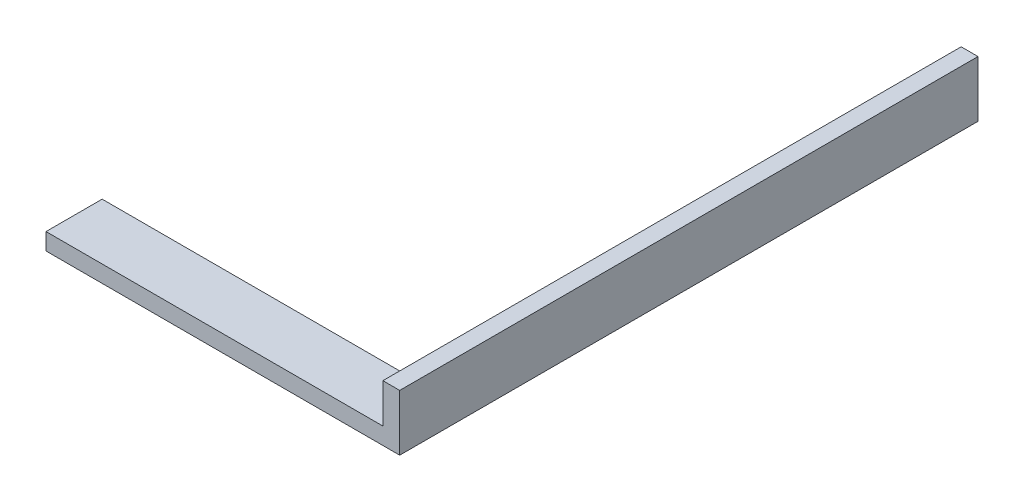
from build123d import *

# Parameters (mm, degrees)
SKETCH_1_W          = 63
SKETCH_1_H          = 10
EXTRUDE_1_DEPTH     = 2
SKETCH_4_W          = 2
SKETCH_4_H          = 10
EXTRUDE_2_DEPTH     = 93
SKETCH_5_W          = 61
SKETCH_5_H          = 10
EXTRUDE_3_DEPTH     = 1
SKETCH_6_W          = 10
SKETCH_6_H          = 92
EXTRUDE_4_DEPTH     = 1
SKETCH_7_W          = 3
SKETCH_7_H          = 10
EXTRUDE_5_DEPTH     = 93
SKETCH_10_W         = 26.594312394
SKETCH_10_H         = 101.559656513
CUT_EXTRUDE_1_DEPTH = 93


with BuildPart() as part:
    # 草图1 → 凸台-拉伸1 (new body)
    with BuildSketch(Plane(origin=(0, 0, 0), x_dir=(1, 0, 0), z_dir=(0, 1, 0))):
        Rectangle(SKETCH_1_W, SKETCH_1_H)
    extrude(amount=EXTRUDE_1_DEPTH)

    # 草图4 → 凸台-拉伸2 (add)
    with BuildSketch(Plane(origin=(0, 2, 0), x_dir=(1, 0, 0), z_dir=(0, 1, 0))):
        with Locations((30.5, 0)):
            Rectangle(SKETCH_4_W, SKETCH_4_H)
    extrude(amount=EXTRUDE_2_DEPTH)

    # 草图5 → 凸台-拉伸3 (add)
    with BuildSketch(Plane(origin=(0, 2, 0), x_dir=(1, 0, 0), z_dir=(0, 1, 0))):
        with Locations((-1, 0)):
            Rectangle(SKETCH_5_W, SKETCH_5_H)
    extrude(amount=EXTRUDE_3_DEPTH)

    # 草图6 → 凸台-拉伸4 (add)
    with BuildSketch(Plane.ZY.offset(-29.5)):
        with Locations((0, 49)):
            Rectangle(SKETCH_6_W, SKETCH_6_H)
    extrude(amount=EXTRUDE_4_DEPTH)

    # 草图7 → 凸台-拉伸5 (add)
    with BuildSketch(Plane(origin=(0, 0, -5), x_dir=(-1, 0, 0), z_dir=(0, 0, -1))):
        with Locations((-30, 5)):
            Rectangle(SKETCH_7_W, SKETCH_7_H)
    extrude(amount=EXTRUDE_5_DEPTH)

    # 草图10 → 切除-拉伸1 (cut)
    with BuildSketch(Plane.ZY.offset(-28.5)):
        with Locations((8.297156197, 60.779828257)):
            Rectangle(SKETCH_10_W, SKETCH_10_H)
    extrude(amount=-CUT_EXTRUDE_1_DEPTH, mode=Mode.SUBTRACT)


solid = part.part
